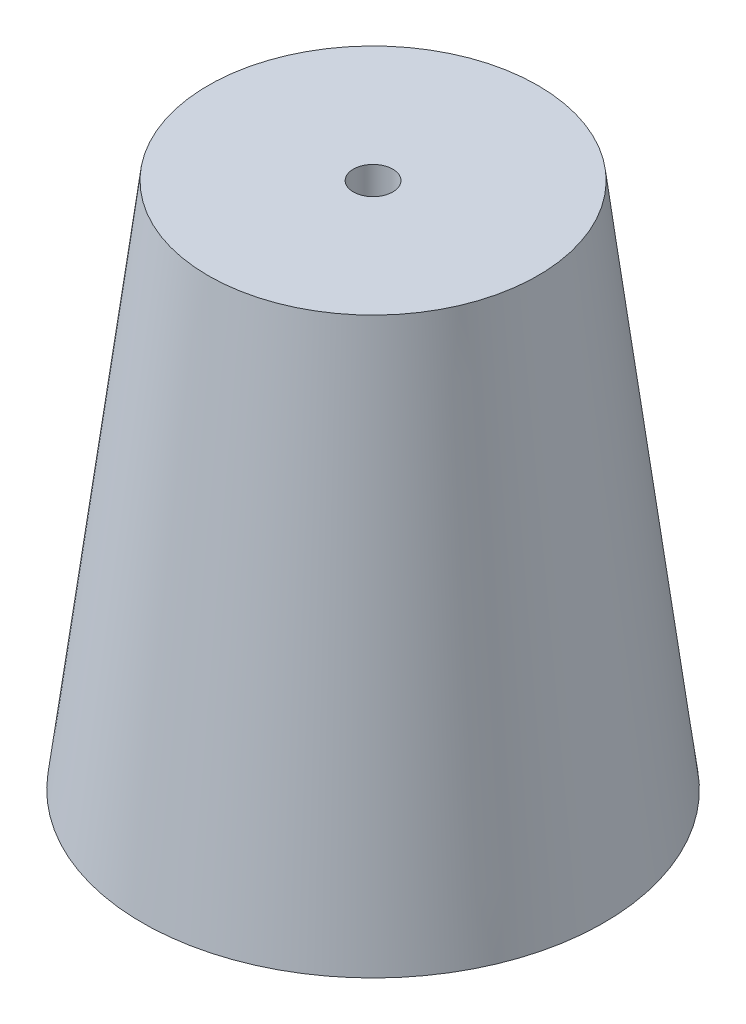
from build123d import *


with BuildPart() as part:
    # Croquis2 → Revolución1 (revolve)
    with BuildSketch(Plane(origin=(0, 0, 0), x_dir=(0, 0, -1), z_dir=(1, 0, 0))):
        Polygon((0, 0), (25, 0), (35, -80), (20, -80), (11.25, -10), (0, -10), align=None)
    revolve(axis=Axis((0, -10, 0), (0, 1, 0)))

    # Croquis5 → Cortar-Revolución1 (revolve, cut)
    with BuildSketch(Plane(origin=(0, 0, 0), x_dir=(0, 0, -1), z_dir=(1, 0, 0))):
        Polygon((0, -10), (0, 0), (2.997515389, 0), (2.997515389, -5), (6, -10), align=None)
    revolve(axis=Axis((0, -10, 0), (0, 1, 0)), mode=Mode.SUBTRACT)


solid = part.part
